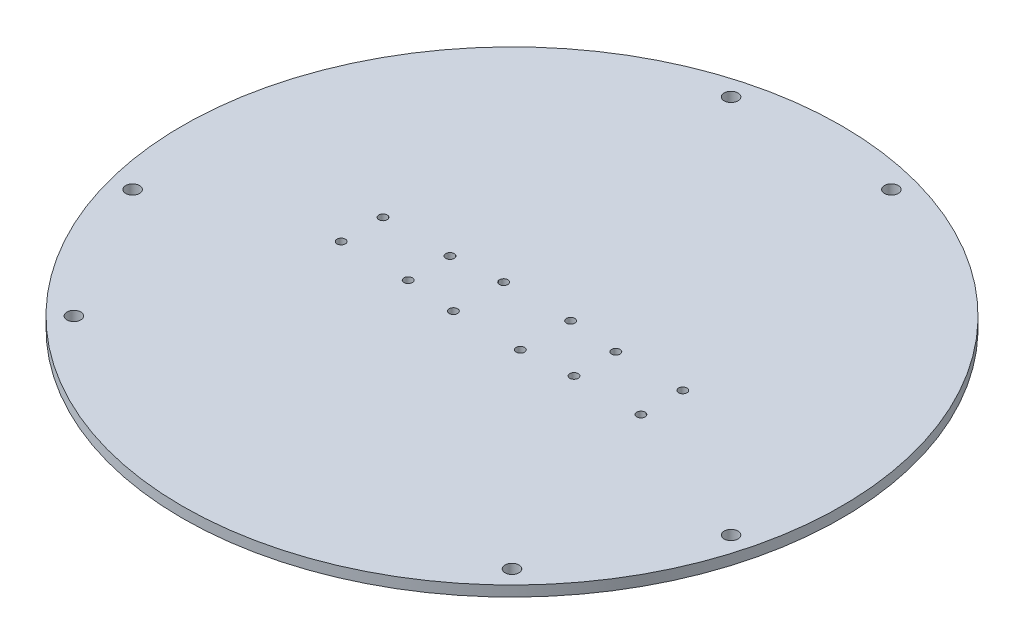
from build123d import *

# Parameters (mm, degrees)
SKETCH1_R           = 100
SKETCH1_R_2         = 2.1
SKETCH1_R_3         = 1.27
BOSS_EXTRUDE1_DEPTH = 3.175


with BuildPart() as part:
    # Sketch1 → Boss-Extrude1 (new body)
    with BuildSketch(Plane(origin=(0, 0, 0), x_dir=(1, 0, 0), z_dir=(0, 1, 0))):
        with Locations(Location((0, 0, 0), (0, 0, 270))):
            Circle(SKETCH1_R)
        with Locations(Location((24.32899024, 90.797027671, 0), (0, 0, 270))):
            Circle(SKETCH1_R_2, mode=Mode.SUBTRACT)
        with Locations(Location((-24.32899024, 90.797027671, 0), (0, 0, 90))):
            Circle(SKETCH1_R_2, mode=Mode.SUBTRACT)
        with Locations(Location((90.797027671, -24.32899024, 0), (0, 0, 90))):
            Circle(SKETCH1_R_2, mode=Mode.SUBTRACT)
        with Locations(Location((66.468037432, -66.468037432, 0), (0, 0, 270))):
            Circle(SKETCH1_R_2, mode=Mode.SUBTRACT)
        with Locations(Location((-66.468037432, -66.468037432, 0), (0, 0, 90))):
            Circle(SKETCH1_R_2, mode=Mode.SUBTRACT)
        with Locations(Location((-90.797027671, -24.32899024, 0), (0, 0, 270))):
            Circle(SKETCH1_R_2, mode=Mode.SUBTRACT)
        with Locations(Location((-10.16, 7.62, 0), (0, 0, 270))):
            Circle(SKETCH1_R_3, mode=Mode.SUBTRACT)
        with Locations(Location((-10.16, -7.62, 0), (0, 0, 270))):
            Circle(SKETCH1_R_3, mode=Mode.SUBTRACT)
        with Locations(Location((10.16, -7.62, 0), (0, 0, 270))):
            Circle(SKETCH1_R_3, mode=Mode.SUBTRACT)
        with Locations(Location((10.16, 7.62, 0), (0, 0, 270))):
            Circle(SKETCH1_R_3, mode=Mode.SUBTRACT)
        with Locations(Location((25.16, 6.35, 0), (0, 0, 270))):
            Circle(SKETCH1_R_3, mode=Mode.SUBTRACT)
        with Locations(Location((25.16, -6.35, 0), (0, 0, 270))):
            Circle(SKETCH1_R_3, mode=Mode.SUBTRACT)
        with Locations(Location((45.48, -6.35, 0), (0, 0, 270))):
            Circle(SKETCH1_R_3, mode=Mode.SUBTRACT)
        with Locations(Location((45.48, 6.35, 0), (0, 0, 270))):
            Circle(SKETCH1_R_3, mode=Mode.SUBTRACT)
        with Locations(Location((-45.48, 6.35, 0), (0, 0, 90))):
            Circle(SKETCH1_R_3, mode=Mode.SUBTRACT)
        with Locations(Location((-45.48, -6.35, 0), (0, 0, 90))):
            Circle(SKETCH1_R_3, mode=Mode.SUBTRACT)
        with Locations(Location((-25.16, -6.35, 0), (0, 0, 90))):
            Circle(SKETCH1_R_3, mode=Mode.SUBTRACT)
        with Locations(Location((-25.16, 6.35, 0), (0, 0, 90))):
            Circle(SKETCH1_R_3, mode=Mode.SUBTRACT)
    extrude(amount=BOSS_EXTRUDE1_DEPTH)


solid = part.part
